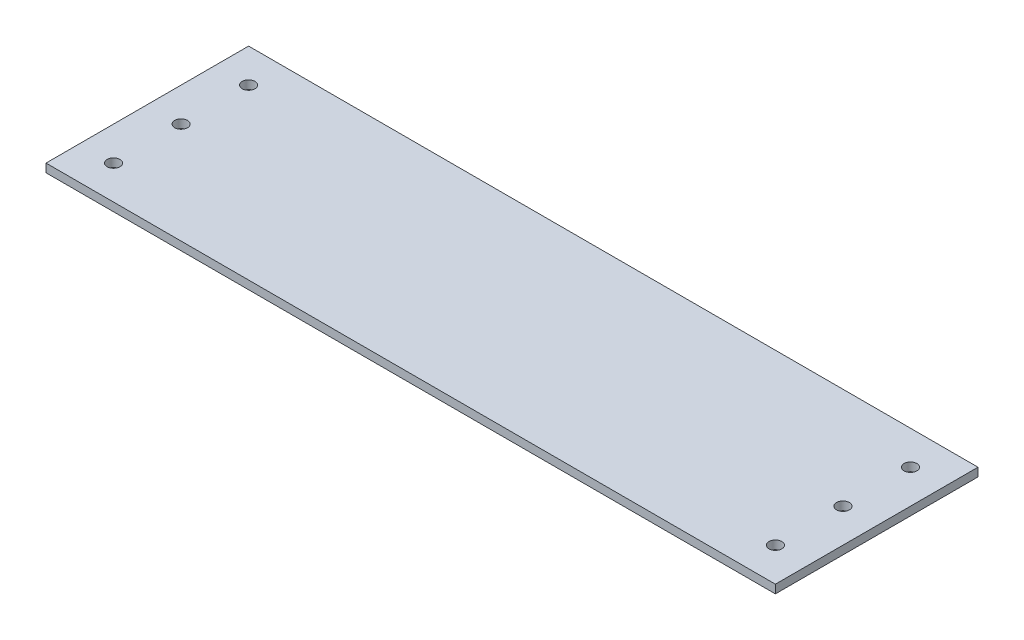
from build123d import *

# Parameters (mm, degrees)
SKETCH1_W           = 274.32
SKETCH1_H           = 76.2
SKETCH1_R           = 2.413
BOSS_EXTRUDE1_DEPTH = 3.175


with BuildPart() as part:
    # Sketch1 → Boss-Extrude1 (new body)
    with BuildSketch(Plane(origin=(0, 0, 0), x_dir=(1, 0, 0), z_dir=(0, 1, 0))):
        with Locations((137.16, 38.1)):
            Rectangle(SKETCH1_W, SKETCH1_H)
        with Locations(Location((12.7, 63.5, 0), (0, 0, 270))):
            Circle(SKETCH1_R, mode=Mode.SUBTRACT)
        with Locations(Location((12.7, 38.1, 0), (0, 0, 270))):
            Circle(SKETCH1_R, mode=Mode.SUBTRACT)
        with Locations(Location((12.7, 12.7, 0), (0, 0, 270))):
            Circle(SKETCH1_R, mode=Mode.SUBTRACT)
        with Locations(Location((261.62, 12.7, 0), (0, 0, 90))):
            Circle(SKETCH1_R, mode=Mode.SUBTRACT)
        with Locations(Location((261.62, 38.1, 0), (0, 0, 90))):
            Circle(SKETCH1_R, mode=Mode.SUBTRACT)
        with Locations(Location((261.62, 63.5, 0), (0, 0, 90))):
            Circle(SKETCH1_R, mode=Mode.SUBTRACT)
    extrude(amount=BOSS_EXTRUDE1_DEPTH)


solid = part.part
